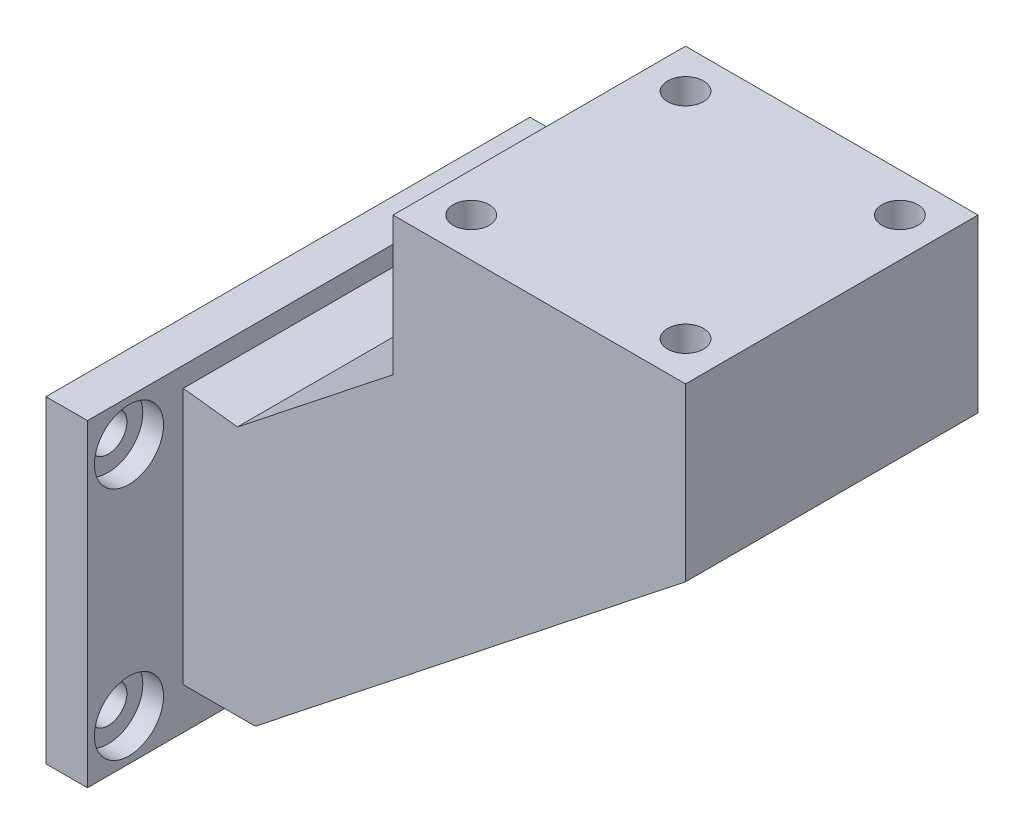
from build123d import *

# Parameters (mm, degrees)
ESTRUSIONE_ESTRUSIONE1_DEPTH                         = 70
TAGLIO_ESTRUSIONE2_DEPTH                             = 133.233968783
TAGLIO_ESTRUSIONE2_DEPTH_BACK                        = 13.85
TAGLIO_ESTRUSIONE3_DEPTH                             = 13.85
FORO_LAMATO_PER_BULLONE_M12_A_TESTA_ESAG_D           = 5.4
FORO_LAMATO_PER_BULLONE_M12_A_TESTA_ESAG_DEPTH       = 18.1
FORO_LAMATO_PER_BULLONE_M12_A_TESTA_ESAG_CBORE_D     = 10
FORO_LAMATO_PER_BULLONE_M12_A_TESTA_ESAG_CBORE_DEPTH = 3
FORO_LAMATO_PER_BULLONE_M12_A_TESTA_ESAG_TIP         = 1.622323671
SMUSSO1_SIZE                                         = 10
SMUSSO1_SIZE2                                        = 7.11916601
FORO_PER_VITE_M4_1_D                                 = 5.2
FORO_PER_VITE_M4_1_DEPTH                             = 8.1
FORO_PER_VITE_M4_1_TIP                               = 1.562237609


with BuildPart() as part:
    # Schizzo1 → Estrusione-Estrusione1 (new body)
    with BuildSketch(Plane.XY):
        Polygon((0, 0), (0, 46), (6, 46), (6, 36), (36.35, 60), (36.35, 80), (78.65, 80), (78.65, 55.203294303), (16.42833408, 6), (6, 6), (6, 0), align=None)
    extrude(amount=ESTRUSIONE_ESTRUSIONE1_DEPTH)

    # Schizzo3 → Taglio-Estrusione2 (cut, two sides: drawn at the far end of the back side and taken through both)
    with BuildSketch(Plane.XY.offset(70).offset(-TAGLIO_ESTRUSIONE2_DEPTH_BACK)):
        Polygon((6, 6), (6, 36), (36.35, 60), (36.35, 80), (78.65, 80), (78.65, 55.203294303), (16.42833408, 6), align=None)
    extrude(amount=TAGLIO_ESTRUSIONE2_DEPTH + TAGLIO_ESTRUSIONE2_DEPTH_BACK, mode=Mode.SUBTRACT)

    # Schizzo4 → Taglio-Estrusione3 (cut)
    with BuildSketch(Plane(origin=(0, 0, 0), x_dir=(-1, 0, 0), z_dir=(0, 0, -1))):
        Polygon((-36.35, 60), (-36.35, 80), (-78.65, 80), (-78.65, 55.203294303), (-16.42833408, 6), (-6, 6), (-6, 36), align=None)
    extrude(amount=-TAGLIO_ESTRUSIONE3_DEPTH, mode=Mode.SUBTRACT)

    # Foro lamato per Bullone M12 a testa esagonale (Classe superiore)-1
    with Locations(Plane(origin=(6, 0, 0), x_dir=(0, 0, -1), z_dir=(1, 0, 0))):
        with Locations((-64, 6), (-6, 6), (-6, 40), (-64, 40)):
            CounterBoreHole(FORO_LAMATO_PER_BULLONE_M12_A_TESTA_ESAG_D / 2, FORO_LAMATO_PER_BULLONE_M12_A_TESTA_ESAG_CBORE_D / 2, FORO_LAMATO_PER_BULLONE_M12_A_TESTA_ESAG_CBORE_DEPTH, depth=FORO_LAMATO_PER_BULLONE_M12_A_TESTA_ESAG_DEPTH)
            with Locations((0, 0, -(FORO_LAMATO_PER_BULLONE_M12_A_TESTA_ESAG_DEPTH + FORO_LAMATO_PER_BULLONE_M12_A_TESTA_ESAG_TIP / 2))):  # 118° drill point
                Cone(0, FORO_LAMATO_PER_BULLONE_M12_A_TESTA_ESAG_D / 2, FORO_LAMATO_PER_BULLONE_M12_A_TESTA_ESAG_TIP, mode=Mode.SUBTRACT)

    # Smusso1
    smusso1_edges = [part.edges().sort_by_distance(p)[0] for p in [
        (6, 36, 35),
    ]]
    smusso1_side = [part.faces().sort_by_distance(p)[0] for p in [
        (21.175, 48, 35),
    ]]
    chamfer(smusso1_edges, length=SMUSSO1_SIZE, length2=SMUSSO1_SIZE2, reference=smusso1_side[0])

    # Foro per Vite M4-1
    with Locations(Plane(origin=(0, 80, 0), x_dir=(1, 0, 0), z_dir=(0, 1, 0))):
        with Locations((42, -19.5), (73, -19.5), (73, -50.5), (42, -50.5)):
            Hole(FORO_PER_VITE_M4_1_D / 2, depth=FORO_PER_VITE_M4_1_DEPTH)
            with Locations((0, 0, -(FORO_PER_VITE_M4_1_DEPTH + FORO_PER_VITE_M4_1_TIP / 2))):  # 118° drill point
                Cone(0, FORO_PER_VITE_M4_1_D / 2, FORO_PER_VITE_M4_1_TIP, mode=Mode.SUBTRACT)


solid = part.part
